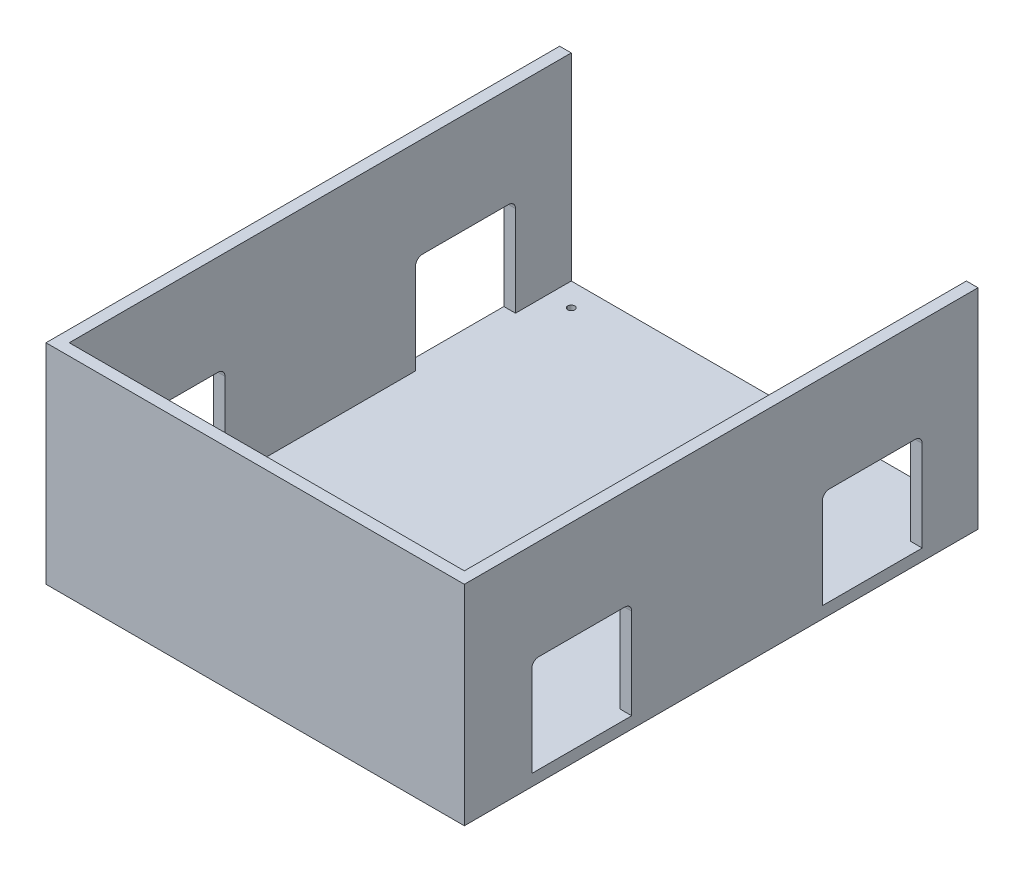
from build123d import *

# Parameters (mm, degrees)
SKETCH1_W           = 170
SKETCH1_H           = 216
BOSS_EXTRUDE1_DEPTH = 5
SKETCH2_R           = 1.5
CUT_EXTRUDE1_DEPTH  = 138.528178931
SKETCH9_W           = 170
SKETCH9_H           = 90
BOSS_EXTRUDE2_DEPTH = 3
SKETCH10_W          = 219
SKETCH10_H          = 90
BOSS_EXTRUDE3_DEPTH = 5
BOSS_EXTRUDE5_START = 5
SKETCH11_W          = 219
SKETCH11_H          = 90
BOSS_EXTRUDE5_DEPTH = 5
SKETCH14_W          = 180
SKETCH14_H          = 90
CUT_EXTRUDE2_DEPTH  = 3
SKETCH15_W          = 180
SKETCH15_H          = 90
BOSS_EXTRUDE6_DEPTH = 5


with BuildPart() as part:
    # Sketch1 → Boss-Extrude1 (new body)
    with BuildSketch(Plane(origin=(0, 0, 0), x_dir=(1, 0, 0), z_dir=(0, 1, 0))):
        Rectangle(SKETCH1_W, SKETCH1_H)
    extrude(amount=BOSS_EXTRUDE1_DEPTH)

    # Sketch2 → Cut-Extrude1 (cut, through all)
    with BuildSketch(Plane(origin=(0, 5, 0), x_dir=(1, 0, 0), z_dir=(0, 1, 0))):
        with Locations(Location((-75, 98, 0), (0, 0, 270))):
            Circle(SKETCH2_R)
        with Locations(Location((75, 98, 0), (0, 0, 270))):
            Circle(SKETCH2_R)
        with Locations(Location((-75, -98, 0), (0, 0, 270))):
            Circle(SKETCH2_R)
        with Locations(Location((75, -98, 0), (0, 0, 270))):
            Circle(SKETCH2_R)
    extrude(amount=-CUT_EXTRUDE1_DEPTH, mode=Mode.SUBTRACT)

    # Sketch9 → Boss-Extrude2 (add)
    with BuildSketch(Plane(origin=(0, 0, -108), x_dir=(-1, 0, 0), z_dir=(0, 0, -1))):
        with Locations((0, 45)):
            Rectangle(SKETCH9_W, SKETCH9_H)
    extrude(amount=BOSS_EXTRUDE2_DEPTH)

    # Sketch10 → Boss-Extrude3 (add)
    with BuildSketch(Plane(origin=(85, 0, 0), x_dir=(0, 0, -1), z_dir=(1, 0, 0))):
        with Locations((1.5, 45)):
            Rectangle(SKETCH10_W, SKETCH10_H)
        with BuildLine():
            Line((-84, 5), (-41, 5))
            Line((-41, 5), (-41, 44))
            ThreePointArc((-41, 44), (-41.878679656, 46.121320344), (-44, 47))
            Line((-44, 47), (-81, 47))
            ThreePointArc((-81, 47), (-83.121320344, 46.121320344), (-84, 44))
            Line((-84, 44), (-84, 5))
        make_face(mode=Mode.SUBTRACT)
        with BuildLine():
            Line((84, 5), (41, 5))
            Line((41, 5), (41, 44))
            ThreePointArc((41, 44), (41.878679656, 46.121320344), (44, 47))
            Line((44, 47), (81, 47))
            ThreePointArc((81, 47), (83.121320344, 46.121320344), (84, 44))
            Line((84, 44), (84, 5))
        make_face(mode=Mode.SUBTRACT)
    extrude(amount=BOSS_EXTRUDE3_DEPTH)

    # Sketch11 → Boss-Extrude5 (add)
    with BuildSketch(Plane.ZY.offset(85).offset(BOSS_EXTRUDE5_START)):
        with Locations((-1.5, 45)):
            Rectangle(SKETCH11_W, SKETCH11_H)
        with BuildLine():
            Line((-84, 5), (-84, 44))
            ThreePointArc((-84, 44), (-83.121320344, 46.121320344), (-81, 47))
            Line((-81, 47), (-44, 47))
            ThreePointArc((-44, 47), (-41.878679656, 46.121320344), (-41, 44))
            Line((-41, 44), (-41, 5))
            Line((-41, 5), (-84, 5))
        make_face(mode=Mode.SUBTRACT)
        with BuildLine():
            Line((41, 5), (41, 44))
            ThreePointArc((41, 44), (41.878679656, 46.121320344), (44, 47))
            Line((44, 47), (81, 47))
            ThreePointArc((81, 47), (83.121320344, 46.121320344), (84, 44))
            Line((84, 44), (84, 5))
            Line((84, 5), (41, 5))
        make_face(mode=Mode.SUBTRACT)
    extrude(amount=-BOSS_EXTRUDE5_DEPTH)

    # Sketch14 → Cut-Extrude2 (cut)
    with BuildSketch(Plane(origin=(0, 0, -111), x_dir=(-1, 0, 0), z_dir=(0, 0, -1))):
        with Locations((0, 45)):
            Rectangle(SKETCH14_W, SKETCH14_H)
    extrude(amount=-CUT_EXTRUDE2_DEPTH, mode=Mode.SUBTRACT)

    # Sketch15 → Boss-Extrude6 (add)
    with BuildSketch(Plane.XY.offset(108)):
        with Locations((0, 45)):
            Rectangle(SKETCH15_W, SKETCH15_H)
    extrude(amount=BOSS_EXTRUDE6_DEPTH)


solid = part.part
